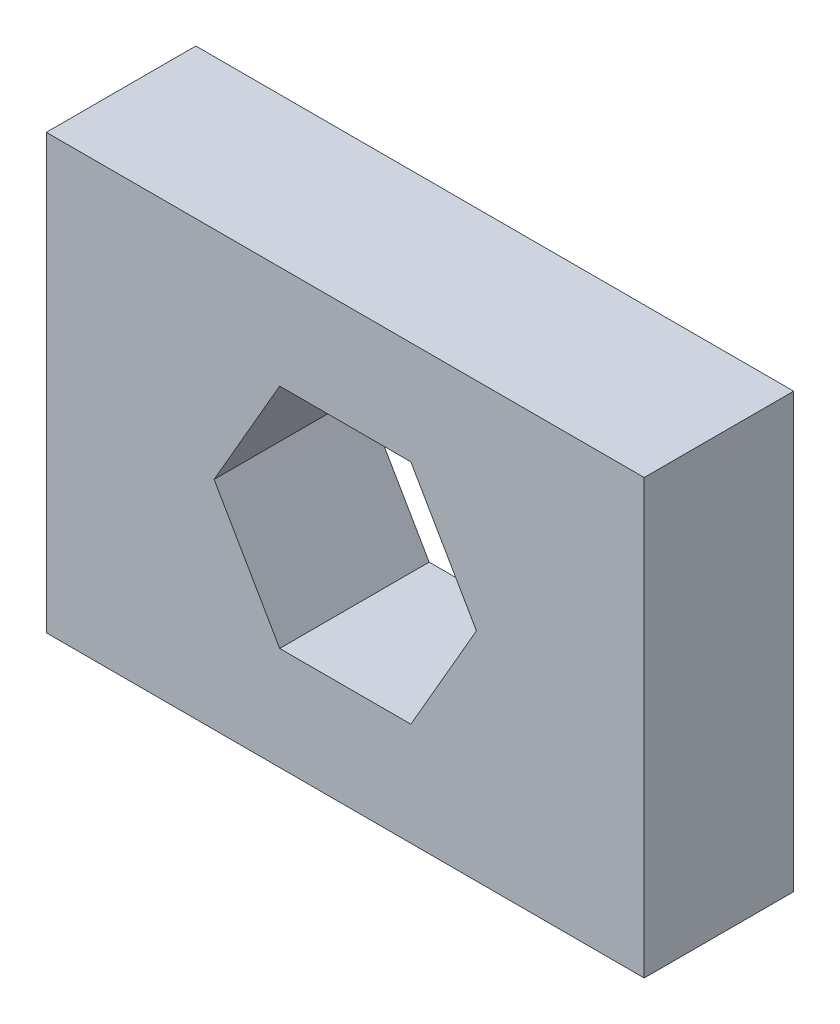
from build123d import *

# Parameters (mm, degrees)
ESQUISSE1_W        = 20
ESQUISSE1_H        = 14.5
BOSS_EXTRU_1_DEPTH = 5


with BuildPart() as part:
    # Esquisse1 → Boss.-Extru.1 (new body)
    with BuildSketch(Plane.XY):
        with Locations((10, 7.25)):
            Rectangle(ESQUISSE1_W, ESQUISSE1_H)
        Polygon((14.387862046, 7.25), (12.193931023, 11.05), (7.806068977, 11.05), (5.612137954, 7.25), (7.806068977, 3.45), (12.193931023, 3.45), align=None, mode=Mode.SUBTRACT)
    extrude(amount=BOSS_EXTRU_1_DEPTH)


solid = part.part
